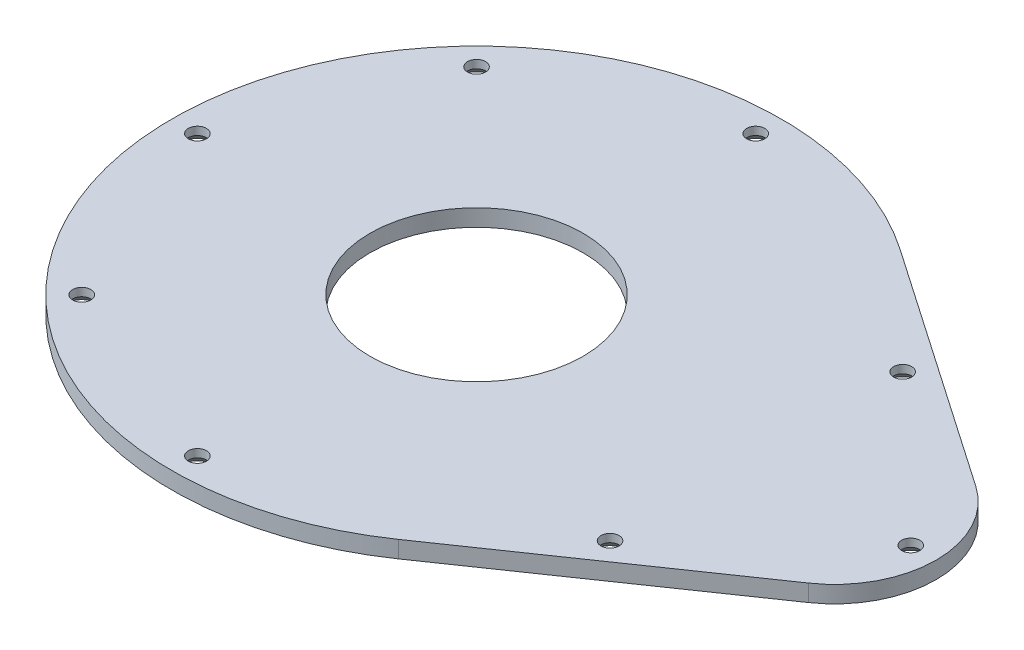
from build123d import *

# Parameters (mm, degrees)
SKETCH1_R                    = 57.15
SKETCH1_R_2                  = 20
BOSS_EXTRUDE1_DEPTH          = 3.175
BOSS_EXTRUDE2_START          = -3.175
BOSS_EXTRUDE2_DEPTH          = 3.175
CSK_FOR_M3_SFHCS1_AT_2_COUNT = 2
CSK_FOR_M3_SFHCS1_AT_2_PITCH = 74.069152487
CSK_FOR_M3_SFHCS1_AT_3_COUNT = 2
CSK_FOR_M3_SFHCS1_AT_3_PITCH = 96.776011479
CSK_FOR_M3_SFHCS1_AT_4_COUNT = 2
CSK_FOR_M3_SFHCS1_AT_4_PITCH = 104.7496
CSK_FOR_M3_SFHCS1_AT_5_COUNT = 2
CSK_FOR_M3_SFHCS1_AT_5_PITCH = 95.534640107
CSK_FOR_M3_SFHCS1_AT_6_COUNT = 2
CSK_FOR_M3_SFHCS1_AT_6_PITCH = 96.842619006
CSK_FOR_M3_SFHCS1_AT_7_COUNT = 2
CSK_FOR_M3_SFHCS1_AT_7_PITCH = 58.10838136
CSK_FOR_M3_SFHCS1_AT_8_COUNT = 2
CSK_FOR_M3_SFHCS1_AT_8_PITCH = 40.085936467


with BuildPart() as part:
    # Sketch1 → Boss-Extrude1 (new body)
    with BuildSketch(Plane(origin=(0, 0, 0), x_dir=(1, 0, 0), z_dir=(0, 1, 0))):
        with Locations(Location((0, 0, 0), (0, 0, 270))):
            Circle(SKETCH1_R)
        with Locations(Location((0, 0, 0), (0, 0, 270))):
            Circle(SKETCH1_R_2, mode=Mode.SUBTRACT)
    extrude(amount=-BOSS_EXTRUDE1_DEPTH)

    # Sketch2 → Boss-Extrude2 (add)
    with BuildSketch(Plane(origin=(0, -3.175, 0), x_dir=(-1, 0, 0), z_dir=(0, -1, 0)).offset(BOSS_EXTRUDE2_START)):
        with BuildLine():
            Line((-32.41020794, 47.071232418), (-77.986402647, 15.690410806))
            ThreePointArc((-77.986402647, 15.690410806), (-86.233, 0), (-77.986402647, -15.690410806))
            Line((-77.986402647, -15.690410806), (-32.41020794, -47.071232418))
            ThreePointArc((-32.41020794, -47.071232418), (-57.15, 0), (-32.41020794, 47.071232418))
        make_face()
    extrude(amount=BOSS_EXTRUDE2_DEPTH)

    # Sketch7 → CSK for M3 SFHCS1 (revolve, cut)
    with BuildSketch(Plane(origin=(0, -3.175, 52.3748), x_dir=(0, 0, -1), z_dir=(1, 0, 0))):
        Polygon((0, 0), (0, 3.175), (1.7, 3.175), (1.7, 1.66), (3.36, 0), align=None)
    csk_for_m3_sfhcs1 = revolve(axis=Axis((0, -9.525, 52.3748), (0, 1, 0)), mode=Mode.SUBTRACT)

    # CSK for M3 SFHCS1 at 2: CSK for M3 SFHCS1 ×2
    with Locations(*[Vector(-0.7071067811865477, 0, -0.7071067811865475) * (i * CSK_FOR_M3_SFHCS1_AT_2_PITCH) for i in range(1, CSK_FOR_M3_SFHCS1_AT_2_COUNT)]):
        add(csk_for_m3_sfhcs1, mode=Mode.SUBTRACT)

    # CSK for M3 SFHCS1 at 3: CSK for M3 SFHCS1 ×2
    with Locations(*[Vector(-0.3826834323650908, 0, -0.9238795325112864) * (i * CSK_FOR_M3_SFHCS1_AT_3_PITCH) for i in range(1, CSK_FOR_M3_SFHCS1_AT_3_COUNT)]):
        add(csk_for_m3_sfhcs1, mode=Mode.SUBTRACT)

    # CSK for M3 SFHCS1 at 4: CSK for M3 SFHCS1 ×2
    with Locations(*[(0, 0, -i * CSK_FOR_M3_SFHCS1_AT_4_PITCH) for i in range(1, CSK_FOR_M3_SFHCS1_AT_4_COUNT)]):
        add(csk_for_m3_sfhcs1, mode=Mode.SUBTRACT)

    # CSK for M3 SFHCS1 at 5: CSK for M3 SFHCS1 ×2
    with Locations(*[Vector(0.5494368566637676, 0, -0.8355352419493978) * (i * CSK_FOR_M3_SFHCS1_AT_5_PITCH) for i in range(1, CSK_FOR_M3_SFHCS1_AT_5_COUNT)]):
        add(csk_for_m3_sfhcs1, mode=Mode.SUBTRACT)

    # CSK for M3 SFHCS1 at 6: CSK for M3 SFHCS1 ×2
    with Locations(*[Vector(0.84113586390326, 0, -0.5408238700868485) * (i * CSK_FOR_M3_SFHCS1_AT_6_PITCH) for i in range(1, CSK_FOR_M3_SFHCS1_AT_6_COUNT)]):
        add(csk_for_m3_sfhcs1, mode=Mode.SUBTRACT)

    # CSK for M3 SFHCS1 at 7: CSK for M3 SFHCS1 ×2
    with Locations(*[Vector(0.9033163742395407, 0, -0.42897497366481663) * (i * CSK_FOR_M3_SFHCS1_AT_7_PITCH) for i in range(1, CSK_FOR_M3_SFHCS1_AT_7_COUNT)]):
        add(csk_for_m3_sfhcs1, mode=Mode.SUBTRACT)

    # CSK for M3 SFHCS1 at 8: CSK for M3 SFHCS1 ×2
    with Locations(*[Vector(-0.9238795325112864, 0, -0.3826834323650906) * (i * CSK_FOR_M3_SFHCS1_AT_8_PITCH) for i in range(1, CSK_FOR_M3_SFHCS1_AT_8_COUNT)]):
        add(csk_for_m3_sfhcs1, mode=Mode.SUBTRACT)


solid = part.part
